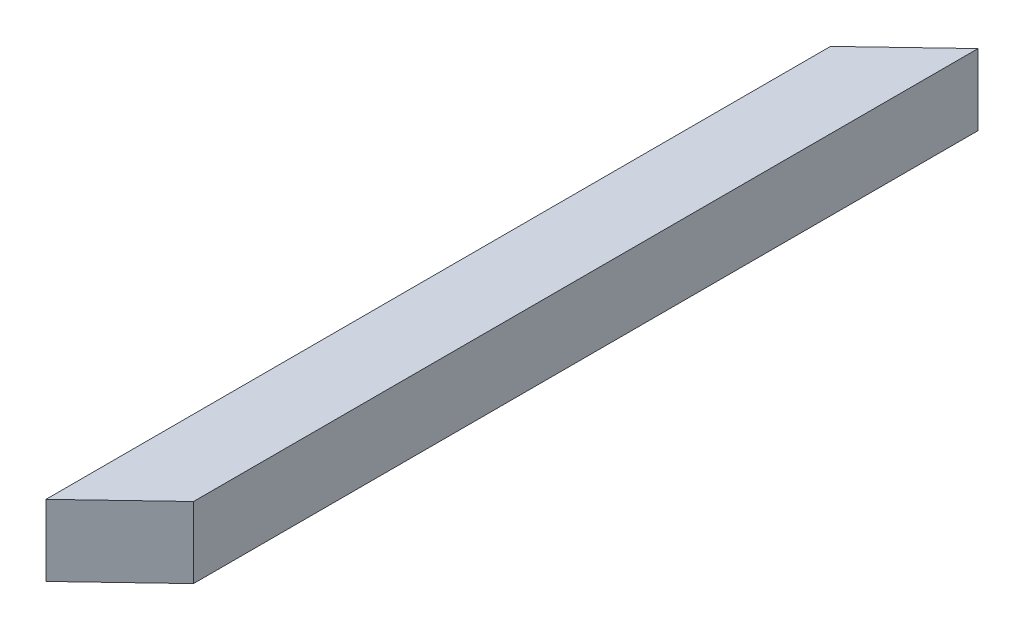
from build123d import *

# Parameters (mm, degrees)
SKETCH1_W           = 50
SKETCH1_H           = 47
BOSS_EXTRUDE1_DEPTH = 566
CUT_EXTRUDE1_DEPTH  = 50


with BuildPart() as part:
    # Sketch1 → Boss-Extrude1 (new body)
    with BuildSketch(Plane.XY):
        with Locations((-4.873944059, 2.488700565)):
            Rectangle(SKETCH1_W, SKETCH1_H)
    extrude(amount=BOSS_EXTRUDE1_DEPTH)

    # Sketch3 → Cut-Extrude1 (cut)
    with BuildSketch(Plane.XZ.offset(21.011299435)):
        Polygon((-29.873944059, 566), (20.126055941, 518.513450403), (20.126055941, 566), align=None)
        Polygon((-29.873944059, 0), (20.126055941, 0), (-29.873944059, 47.479214409), align=None)
    extrude(amount=-CUT_EXTRUDE1_DEPTH, mode=Mode.SUBTRACT)


solid = part.part
